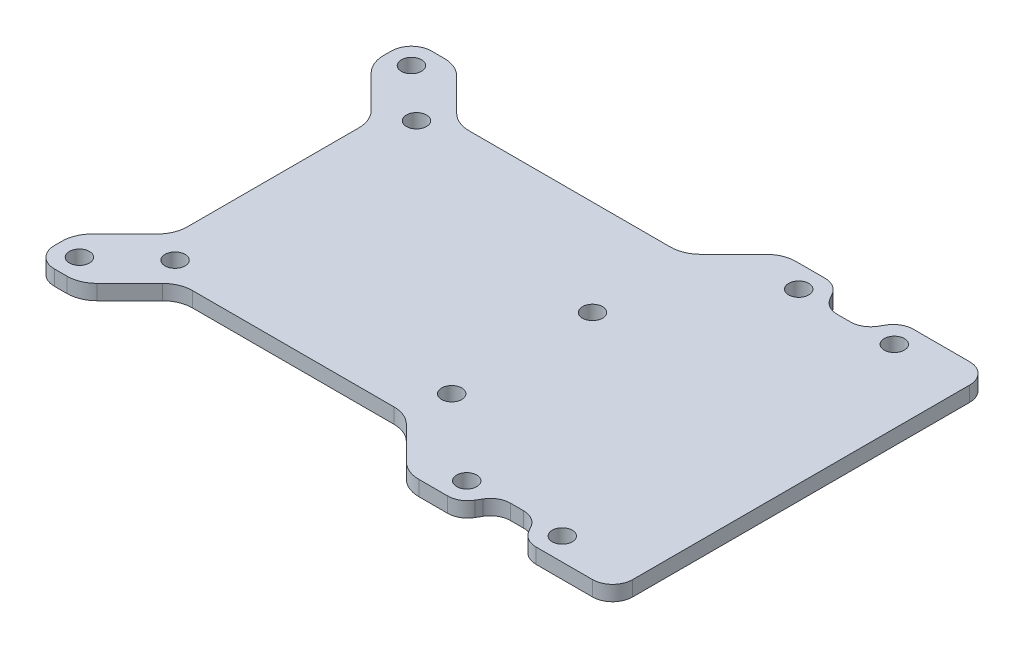
from build123d import *

# Parameters (mm, degrees)
SKETCH_1_W          = 105
SKETCH_1_H          = 75
SKETCH_1_R          = 2
EXTRUDE_1_DEPTH     = 3
SKETCH_3_R          = 2
CUT_EXTRUDE_2_DEPTH = 30.8
SKETCH_6_R          = 2
CUT_EXTRUDE_4_DEPTH = 15
FILLET_1_R          = 4
SKETCH_7_W          = 10
SKETCH_7_H          = 75
EXTRUDE_2_DEPTH     = 3
FILLET_2_R          = 4
CUT_EXTRUDE_START   = -3
SKETCH_8_R          = 2
CUT_EXTRUDE_5_DEPTH = 3
CUT_EXTRUDE_6_DEPTH = 10
FILLET_3_R          = 6
CUT_EXTRUDE_7_DEPTH = 10
FILLET_4_R          = 4


with BuildPart() as part:
    # 스케치1 → 보스-돌출1 (new body)
    with BuildSketch(Plane(origin=(0, 0, 0), x_dir=(1, 0, 0), z_dir=(0, 1, 0))):
        Rectangle(SKETCH_1_W, SKETCH_1_H)
        with Locations((48, 33)):
            Circle(SKETCH_1_R, mode=Mode.SUBTRACT)
        with Locations((-48, 33)):
            Circle(SKETCH_1_R, mode=Mode.SUBTRACT)
        with Locations((-48, -33)):
            Circle(SKETCH_1_R, mode=Mode.SUBTRACT)
        with Locations((48, -33)):
            Circle(SKETCH_1_R, mode=Mode.SUBTRACT)
    extrude(amount=EXTRUDE_1_DEPTH)

    # 스케치3 → 컷-돌출2 (cut)
    with BuildSketch(Plane(origin=(0, 3, 0), x_dir=(1, 0, 0), z_dir=(0, 1, 0))):
        with Locations((-37.99, 24)):
            Circle(SKETCH_3_R)
    extrude(amount=-CUT_EXTRUDE_2_DEPTH, mode=Mode.SUBTRACT)

    # 스케치6 → 컷-돌출4 (cut)
    with BuildSketch(Plane(origin=(0, 3, 0), x_dir=(1, 0, 0), z_dir=(0, 1, 0))):
        with Locations((-37.99, -24)):
            Circle(SKETCH_6_R)
        with Locations((12.51, 8.5)):
            Circle(SKETCH_6_R)
        with Locations((12.51, -19.5)):
            Circle(SKETCH_6_R)
    extrude(amount=-CUT_EXTRUDE_4_DEPTH, mode=Mode.SUBTRACT)

    # 필렛1
    fillet_1_edges = [part.edges().sort_by_distance(p)[0] for p in [
        (-52.5, 1.5, 37.5),
        (-52.5, 1.5, -37.5),
    ]]
    fillet(fillet_1_edges, radius=FILLET_1_R)

    # 스케치7 → 보스-돌출2 (add)
    with BuildSketch(Plane(origin=(0, 0, 0), x_dir=(1, 0, 0), z_dir=(0, 1, 0))):
        with Locations((57.5, 0)):
            Rectangle(SKETCH_7_W, SKETCH_7_H)
    extrude(amount=EXTRUDE_2_DEPTH)

    # 필렛2
    fillet_2_edges = [part.edges().sort_by_distance(p)[0] for p in [
        (62.5, 1.5, -37.5),
        (62.5, 1.5, 37.5),
    ]]
    fillet(fillet_2_edges, radius=FILLET_2_R)

    # 스케치8 → 컷-돌출5 (cut)
    with BuildSketch(Plane(origin=(0, 3, 0), x_dir=(1, 0, 0), z_dir=(0, 1, 0)).offset(CUT_EXTRUDE_START)):
        with Locations((29, -33)):
            Circle(SKETCH_8_R)
        with Locations((29, 33)):
            Circle(SKETCH_8_R)
        with Locations((48, -33)):
            Circle(SKETCH_8_R)
        with Locations((48, 33)):
            Circle(SKETCH_8_R)
    extrude(amount=CUT_EXTRUDE_5_DEPTH, mode=Mode.SUBTRACT)

    # 스케치9 → 컷-돌출6 (cut)
    with BuildSketch(Plane(origin=(0, 3, 0), x_dir=(1, 0, 0), z_dir=(0, 1, 0))):
        Polygon((-52.5, 29.5), (-42.5, 19.5), (-42.5, -19.5), (-52.5, -29.5), align=None)
        Polygon((-43.5, -37.5), (-33.5, -27.5), (11.5, -27.5), (21.5, -37.5), align=None)
        Polygon((-43.5, 37.5), (-33.5, 27.5), (11.5, 27.5), (21.5, 37.5), align=None)
    extrude(amount=-CUT_EXTRUDE_6_DEPTH, mode=Mode.SUBTRACT)

    # 필렛3
    fillet_3_edges = [part.edges().sort_by_distance(p)[0] for p in [
        (11.5, 1.5, -27.5),
        (21.5, 1.5, -37.5),
        (-33.5, 1.5, -27.5),
        (-43.5, 1.5, -37.5),
        (21.5, 1.5, 37.5),
        (11.5, 1.5, 27.5),
        (-43.5, 1.5, 37.5),
        (-33.5, 1.5, 27.5),
        (-52.5, 1.5, 29.5),
        (-42.5, 1.5, 19.5),
        (-42.5, 1.5, -19.5),
        (-52.5, 1.5, -29.5),
    ]]
    fillet(fillet_3_edges, radius=FILLET_3_R)

    # 스케치10 → 컷-돌출7 (cut)
    with BuildSketch(Plane(origin=(0, 3, 0), x_dir=(1, 0, 0), z_dir=(0, 1, 0))):
        Polygon((32, -37.5), (34.886751346, -32.5), (42.113248654, -32.5), (45, -37.5), align=None)
        Polygon((32, 37.5), (34.886751346, 32.5), (42.113248654, 32.5), (45, 37.5), align=None)
    extrude(amount=-CUT_EXTRUDE_7_DEPTH, mode=Mode.SUBTRACT)

    # 필렛4
    fillet_4_edges = [part.edges().sort_by_distance(p)[0] for p in [
        (45, 1.5, -37.5),
        (42.113248654, 1.5, -32.5),
        (32, 1.5, -37.5),
        (34.886751346, 1.5, -32.5),
        (45, 1.5, 37.5),
        (42.113248654, 1.5, 32.5),
        (34.886751346, 1.5, 32.5),
        (32, 1.5, 37.5),
    ]]
    fillet(fillet_4_edges, radius=FILLET_4_R)


solid = part.part
